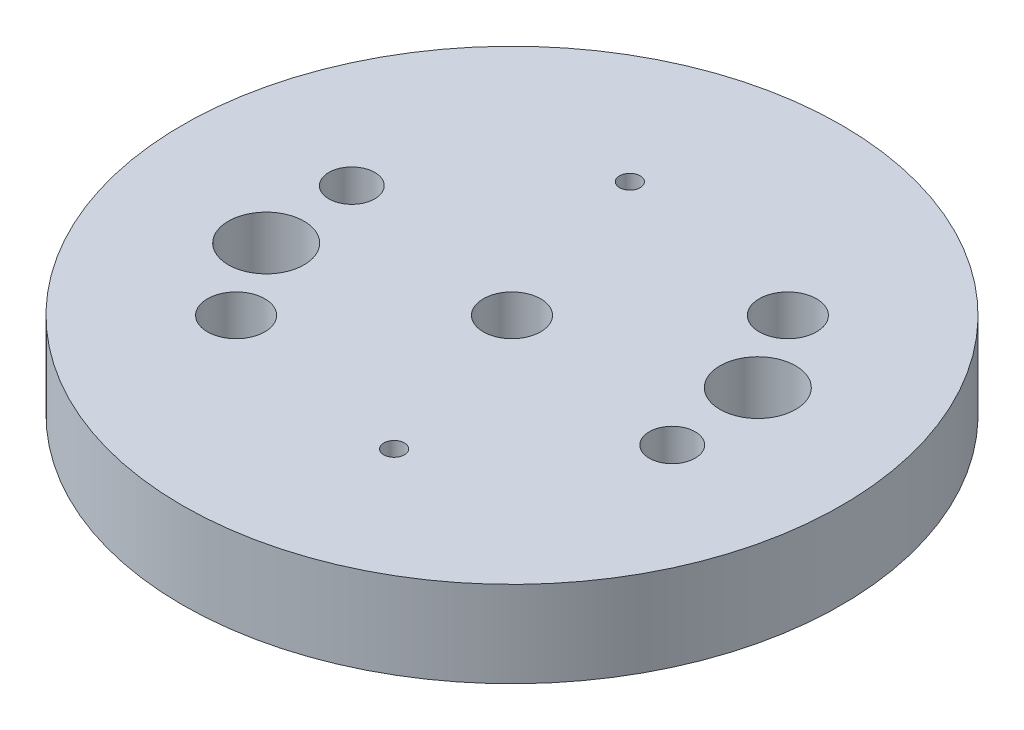
from build123d import *

# Parameters (mm, degrees)
SKETCH1_R           = 36.4744
BOSS_EXTRUDE1_DEPTH = 9.525
SKETCH2_R           = 26.543
BOSS_EXTRUDE2_DEPTH = 3.175
SKETCH5_R           = 3.175
SKETCH5_R_2         = 1.143
SKETCH5_R_3         = 4.191
SKETCH5_R_4         = 2.54
CUT_EXTRUDE1_DEPTH  = 54.123005475


with BuildPart() as part:
    # Sketch1 → Boss-Extrude1 (new body)
    with BuildSketch(Plane(origin=(0, 0, 0), x_dir=(1, 0, 0), z_dir=(0, 1, 0))):
        with Locations(Location((0, 0, 0), (0, 0, 270))):
            Circle(SKETCH1_R)
    extrude(amount=-BOSS_EXTRUDE1_DEPTH)

    # Sketch2 → Boss-Extrude2 (add)
    with BuildSketch(Plane.XZ.offset(9.525)):
        with Locations(Location((0, 0, 0), (0, 0, 270))):
            Circle(SKETCH2_R)
    extrude(amount=BOSS_EXTRUDE2_DEPTH)

    # Sketch5 → Cut-Extrude1 (cut, through all)
    with BuildSketch(Plane(origin=(0, 0, 0), x_dir=(1, 0, 0), z_dir=(0, 1, 0))):
        with Locations(Location((0, 0, 0), (0, 0, 270))):
            Circle(SKETCH5_R)
        with Locations(Location((-6.279225326, 19.325468411, 0), (0, 0, 270))):
            Circle(SKETCH5_R_2)
        with Locations(Location((-20.533310187, -6.671676909, 0), (0, 0, 270))):
            Circle(SKETCH5_R_3)
        with Locations(Location((-15.266435406, -15.266435406, 0), (0, 0, 270))):
            Circle(SKETCH5_R)
        with Locations(Location((15.266435406, 15.266435406, 0), (0, 0, 270))):
            Circle(SKETCH5_R)
        with Locations(Location((6.279225326, -19.325468411, 0), (0, 0, 270))):
            Circle(SKETCH5_R_2)
        with Locations(Location((20.533310187, 6.671676909, 0), (0, 0, 270))):
            Circle(SKETCH5_R_3)
        with Locations(Location((21.293906137, -3.563377811, 0), (0, 0, 270))):
            Circle(SKETCH5_R_4)
        with Locations(Location((-21.293906137, 3.563377811, 0), (0, 0, 270))):
            Circle(SKETCH5_R_4)
    extrude(amount=-CUT_EXTRUDE1_DEPTH, mode=Mode.SUBTRACT)


solid = part.part
